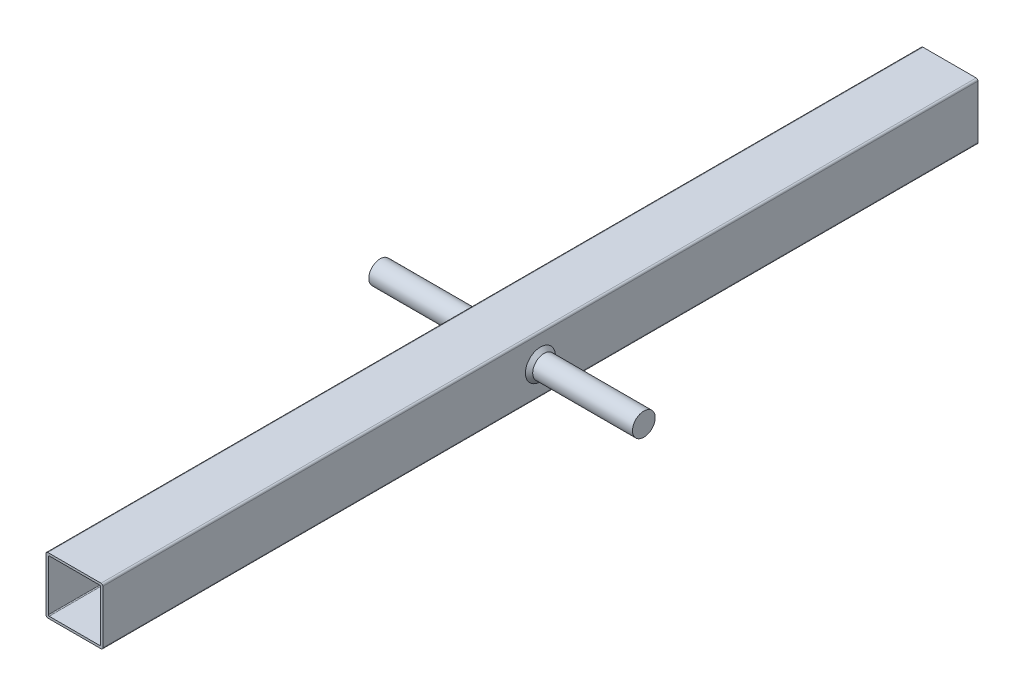
from build123d import *

# Parameters (mm, degrees)
SKETCH1_W           = 39.6875
SKETCH1_H           = 39.6875
SKETCH1_W_2         = 36.5125
SKETCH1_H_2         = 36.5125
BOSS_EXTRUDE1_DEPTH = 305.59375
FILLET1_R           = 1.27
FILLET2_R           = 0.635
SKETCH2_R           = 7.9375
BOSS_EXTRUDE2_DEPTH = 92.075
CHAMFER1_SIZE       = 2.54


with BuildPart() as part:
    # Sketch1 → Boss-Extrude1 (new, symmetric)
    with BuildSketch(Plane.XY):
        Rectangle(SKETCH1_W, SKETCH1_H)
        Rectangle(SKETCH1_W_2, SKETCH1_H_2, mode=Mode.SUBTRACT)
    extrude(amount=BOSS_EXTRUDE1_DEPTH, both=True)

    # Fillet1
    fillet1_edges = [part.edges().sort_by_distance(p)[0] for p in [
        (-19.84375, 19.84375, 0),
        (19.84375, 19.84375, 0),
        (19.84375, -19.84375, 0),
        (-19.84375, -19.84375, 0),
    ]]
    fillet(fillet1_edges, radius=FILLET1_R)

    # Fillet2
    fillet2_edges = [part.edges().sort_by_distance(p)[0] for p in [
        (18.25625, -18.25625, 0),
        (18.25625, 18.25625, 0),
        (-18.25625, 18.25625, 0),
        (-18.25625, -18.25625, 0),
    ]]
    fillet(fillet2_edges, radius=FILLET2_R)

    # Sketch2 → Boss-Extrude2 (add, symmetric)
    with BuildSketch(Plane(origin=(0, 0, 0), x_dir=(0, 0, -1), z_dir=(1, 0, 0))):
        with Locations(Location((0, 0, 0), (0, 0, 270))):
            Circle(SKETCH2_R)
    extrude(amount=BOSS_EXTRUDE2_DEPTH, both=True)

    # Chamfer1
    chamfer1_edges = [part.edges().sort_by_distance(p)[0] for p in [
        (19.84375, 7.9375, 0),
        (-19.84375, 7.9375, 0),
    ]]
    chamfer(chamfer1_edges, length=CHAMFER1_SIZE)


solid = part.part
